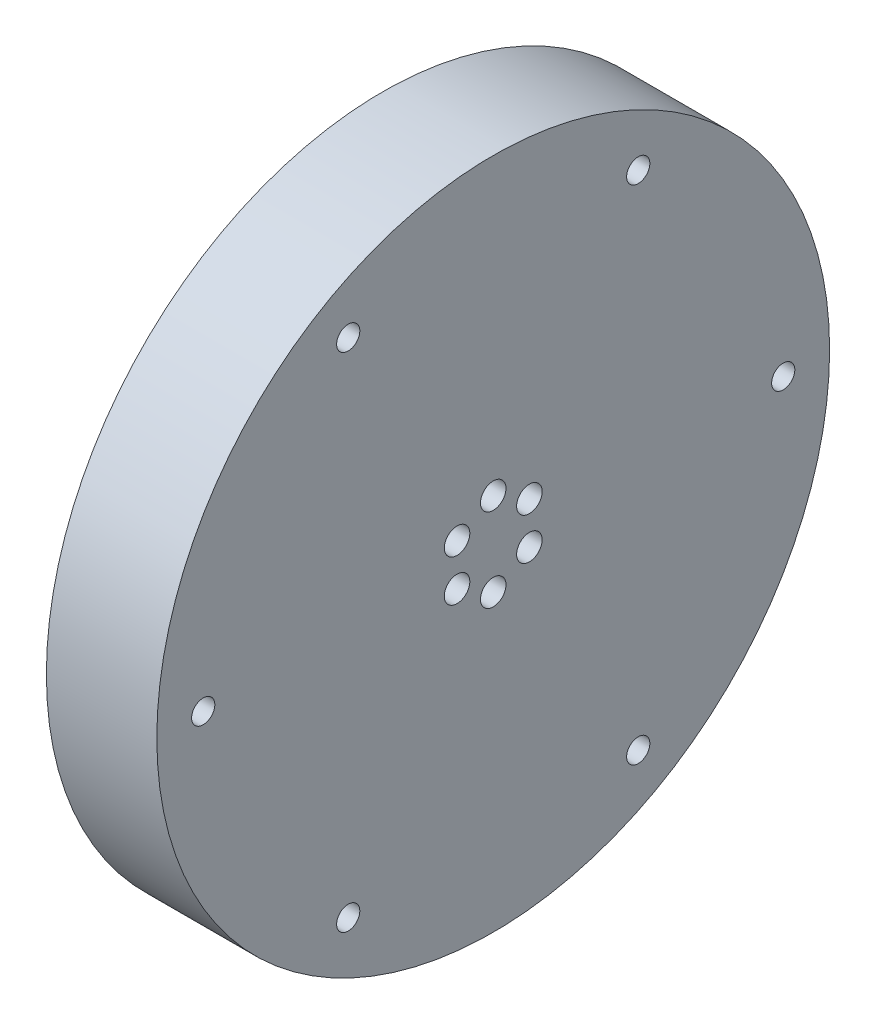
from build123d import *

# Parameters (mm, degrees)
SKETCH1_R                   = 72.5
BOSS_EXTRUDE1_DEPTH         = 10
SKETCH1_3_R                 = 12.5
BOSS_EXTRUDE2_DEPTH         = 11.55
SKETCH1_4_R                 = 49.75
SKETCH1_4_R_2               = 37.75
BOSS_EXTRUDE3_DEPTH         = 6
BOSS_EXTRUDE4_START         = -13.8
SKETCH1_5_R                 = 72.5
SKETCH1_5_R_2               = 67.525
BOSS_EXTRUDE4_DEPTH         = 13.8
CUT_EXTRUDE1_REACH          = 111.771
CUT_EXTRUDE1_START          = -5
SKETCH2_R                   = 2.75
M3_TAPPED_HOLE1_D           = 2.5
M3_TAPPED_HOLE1_CSINK_D     = 3.05
M3_TAPPED_HOLE1_CSINK_ANGLE = 90
SKETCH6_R                   = 2.5
CUT_EXTRUDE2_DEPTH          = 6


with BuildPart() as part:
    # Sketch1 → Boss-Extrude1 (new body)
    with BuildSketch(Plane(origin=(0, 0, 0), x_dir=(0, 0, -1), z_dir=(1, 0, 0))):
        Circle(SKETCH1_R)
    extrude(amount=BOSS_EXTRUDE1_DEPTH)

    # Sketch1<3> → Boss-Extrude2 (add)
    with BuildSketch(Plane(origin=(0, 0, 0), x_dir=(0, 0, -1), z_dir=(1, 0, 0))):
        Circle(SKETCH1_3_R)
    extrude(amount=-BOSS_EXTRUDE2_DEPTH)

    # Sketch1<4> → Boss-Extrude3 (add)
    with BuildSketch(Plane(origin=(0, 0, 0), x_dir=(0, 0, -1), z_dir=(1, 0, 0))):
        Circle(SKETCH1_4_R)
        Circle(SKETCH1_4_R_2, mode=Mode.SUBTRACT)
    extrude(amount=-BOSS_EXTRUDE3_DEPTH)

    # Sketch1<5> → Boss-Extrude4 (add)
    with BuildSketch(Plane(origin=(0, 0, 0), x_dir=(0, 0, -1), z_dir=(1, 0, 0)).offset(BOSS_EXTRUDE4_START)):
        Circle(SKETCH1_5_R)
        Circle(SKETCH1_5_R_2, mode=Mode.SUBTRACT)
    extrude(amount=BOSS_EXTRUDE4_DEPTH)

    # Sketch2 → Cut-Extrude1 (cut, up to next)
    with BuildSketch(Plane.ZY.offset(11.55).offset(CUT_EXTRUDE1_START), mode=Mode.PRIVATE) as cut_extrude1_sk1:
        with Locations((0, 9)):
            Circle(SKETCH2_R)
    cut_extrude1_tool1 = extrude(cut_extrude1_sk1.sketch, amount=-CUT_EXTRUDE1_REACH, mode=Mode.PRIVATE) & part.part
    # Sketch2 → Cut-Extrude1 (cut, up to next)
    with BuildSketch(Plane.ZY.offset(11.55).offset(CUT_EXTRUDE1_START), mode=Mode.PRIVATE) as cut_extrude1_sk2:
        with Locations((7.794228634, 4.5)):
            Circle(SKETCH2_R)
    cut_extrude1_tool2 = extrude(cut_extrude1_sk2.sketch, amount=-CUT_EXTRUDE1_REACH, mode=Mode.PRIVATE) & part.part
    # Sketch2 → Cut-Extrude1 (cut, up to next)
    with BuildSketch(Plane.ZY.offset(11.55).offset(CUT_EXTRUDE1_START), mode=Mode.PRIVATE) as cut_extrude1_sk3:
        with Locations((7.794228634, -4.5)):
            Circle(SKETCH2_R)
    cut_extrude1_tool3 = extrude(cut_extrude1_sk3.sketch, amount=-CUT_EXTRUDE1_REACH, mode=Mode.PRIVATE) & part.part
    # Sketch2 → Cut-Extrude1 (cut, up to next)
    with BuildSketch(Plane.ZY.offset(11.55).offset(CUT_EXTRUDE1_START), mode=Mode.PRIVATE) as cut_extrude1_sk4:
        with Locations((0, -9)):
            Circle(SKETCH2_R)
    cut_extrude1_tool4 = extrude(cut_extrude1_sk4.sketch, amount=-CUT_EXTRUDE1_REACH, mode=Mode.PRIVATE) & part.part
    # Sketch2 → Cut-Extrude1 (cut, up to next)
    with BuildSketch(Plane.ZY.offset(11.55).offset(CUT_EXTRUDE1_START), mode=Mode.PRIVATE) as cut_extrude1_sk5:
        with Locations((-7.794228634, -4.5)):
            Circle(SKETCH2_R)
    cut_extrude1_tool5 = extrude(cut_extrude1_sk5.sketch, amount=-CUT_EXTRUDE1_REACH, mode=Mode.PRIVATE) & part.part
    # Sketch2 → Cut-Extrude1 (cut, up to next)
    with BuildSketch(Plane.ZY.offset(11.55).offset(CUT_EXTRUDE1_START), mode=Mode.PRIVATE) as cut_extrude1_sk6:
        with Locations((-7.794228634, 4.5)):
            Circle(SKETCH2_R)
    cut_extrude1_tool6 = extrude(cut_extrude1_sk6.sketch, amount=-CUT_EXTRUDE1_REACH, mode=Mode.PRIVATE) & part.part
    add(cut_extrude1_tool1.solids().sort_by_distance((-6.55, 9, 0))[0], mode=Mode.SUBTRACT)
    add(cut_extrude1_tool2.solids().sort_by_distance((-6.55, 4.5, 7.794229))[0], mode=Mode.SUBTRACT)
    add(cut_extrude1_tool3.solids().sort_by_distance((-6.55, -4.5, 7.794229))[0], mode=Mode.SUBTRACT)
    add(cut_extrude1_tool4.solids().sort_by_distance((-6.55, -9, 0))[0], mode=Mode.SUBTRACT)
    add(cut_extrude1_tool5.solids().sort_by_distance((-6.55, -4.5, -7.794229))[0], mode=Mode.SUBTRACT)
    add(cut_extrude1_tool6.solids().sort_by_distance((-6.55, 4.5, -7.794229))[0], mode=Mode.SUBTRACT)

    # M3 Tapped Hole1 (through all)
    with Locations(Plane.ZY.offset(11.55)):
        with Locations((0, 9), (7.794228634, 4.5), (7.794228634, -4.5), (0, -9), (-7.794228634, -4.5), (-7.794228634, 4.5)):
            CounterSinkHole(M3_TAPPED_HOLE1_D / 2, M3_TAPPED_HOLE1_CSINK_D / 2, counter_sink_angle=M3_TAPPED_HOLE1_CSINK_ANGLE)

    # Sketch6 → Cut-Extrude2 (cut)
    with BuildSketch(Plane(origin=(10, 0, 0), x_dir=(0, 0, -1), z_dir=(1, 0, 0))):
        with Locations((-62.5, 0)):
            Circle(SKETCH6_R)
        with Locations((-31.25, 54.126587737)):
            Circle(SKETCH6_R)
        with Locations((31.25, 54.126587737)):
            Circle(SKETCH6_R)
        with Locations((62.5, 0)):
            Circle(SKETCH6_R)
        with Locations((31.25, -54.126587737)):
            Circle(SKETCH6_R)
        with Locations((-31.25, -54.126587737)):
            Circle(SKETCH6_R)
    extrude(amount=-CUT_EXTRUDE2_DEPTH, mode=Mode.SUBTRACT)


solid = part.part
